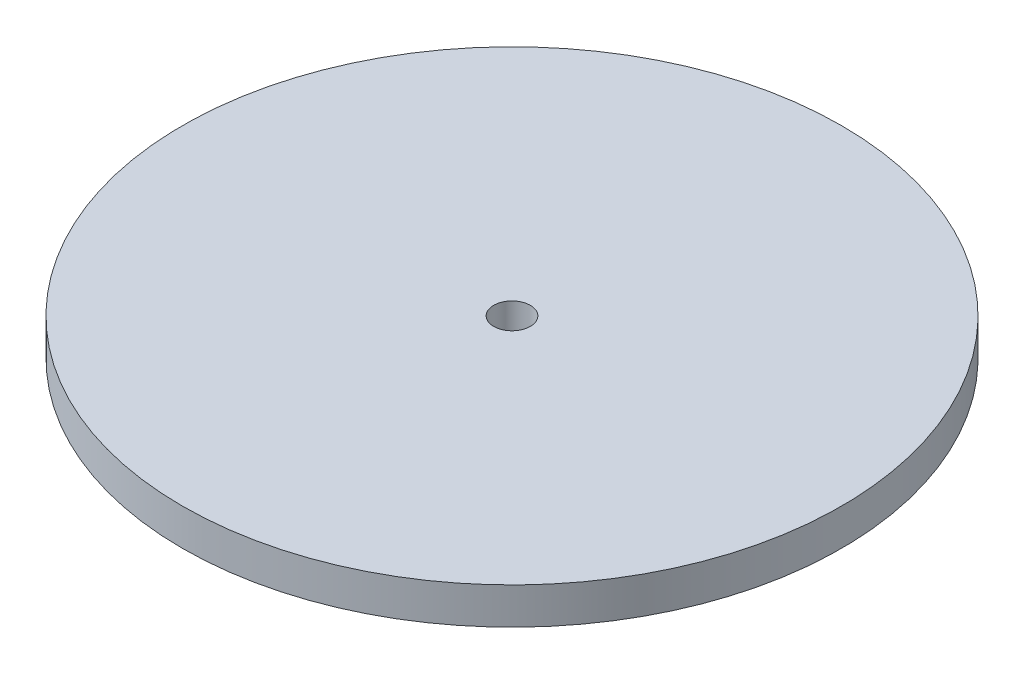
from build123d import *

# Parameters (mm, degrees)
SKETCH1_R           = 45
SKETCH1_R_2         = 2.5
BOSS_EXTRUDE1_DEPTH = 5


with BuildPart() as part:
    # Sketch1 → Boss-Extrude1 (new body)
    with BuildSketch(Plane(origin=(0, 0, 0), x_dir=(1, 0, 0), z_dir=(0, 1, 0))):
        with Locations(Location((0, 0, 0), (0, 0, 270))):
            Circle(SKETCH1_R)
        with Locations(Location((0, 0, 0), (0, 0, 270))):
            Circle(SKETCH1_R_2, mode=Mode.SUBTRACT)
    extrude(amount=BOSS_EXTRUDE1_DEPTH)


solid = part.part
